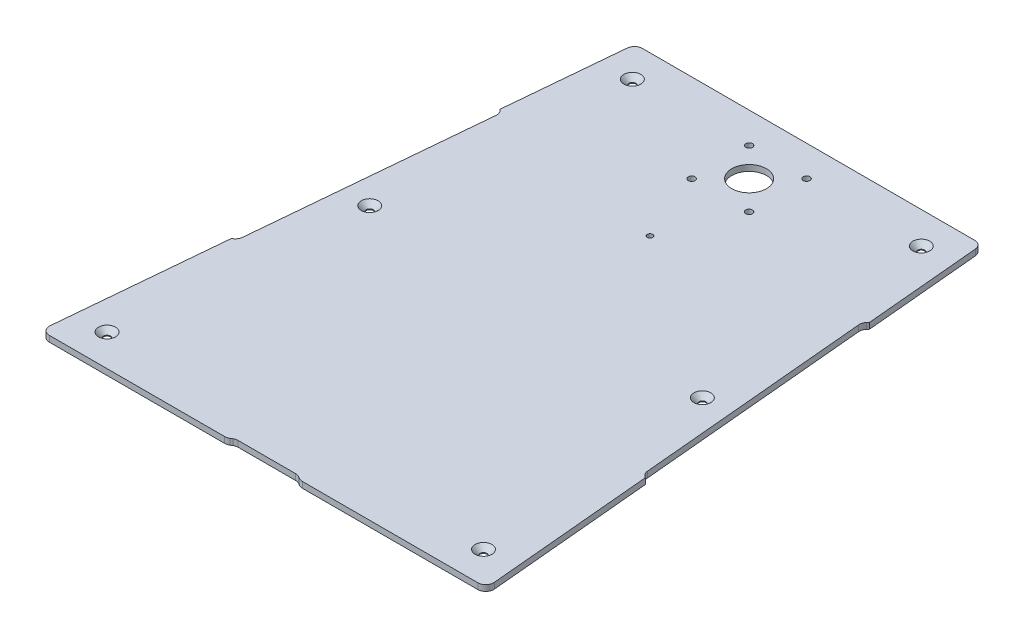
from build123d import *

# Parameters (mm, degrees)
SKETCH1_R           = 17.5
SKETCH1_R_2         = 3.4
SKETCH1_R_3         = 2.731026391
BOSS_EXTRUDE1_DEPTH = 6
FILLET1_R           = 8
SKETCH5_R           = 3.4
CUT_EXTRUDE4_DEPTH  = 20
CUT_EXTRUDE5_DEPTH  = 10
CUT_EXTRUDE6_DEPTH  = 10
FILLET2_R           = 8
CHAMFER1_SIZE       = 5.15


with BuildPart() as part:
    # Sketch1 → Boss-Extrude1 (new body)
    with BuildSketch(Plane(origin=(0, 0, 0), x_dir=(1, 0, 0), z_dir=(0, 1, 0))):
        Polygon((-175, 275), (-225, -275), (225, -275), (175, 275), align=None)
        with Locations(Location((0, 215, 0), (0, 0, 270))):
            Circle(SKETCH1_R, mode=Mode.SUBTRACT)
        with Locations(Location((-145.777131586, 243, 0), (0, 0, 270))):
            Circle(SKETCH1_R_2, mode=Mode.SUBTRACT)
        with Locations(Location((145.777131586, 243, 0), (0, 0, 90))):
            Circle(SKETCH1_R_2, mode=Mode.SUBTRACT)
        with Locations(Location((-189.958949768, -243, 0), (0, 0, 270))):
            Circle(SKETCH1_R_2, mode=Mode.SUBTRACT)
        with Locations(Location((189.958949768, -243, 0), (0, 0, 90))):
            Circle(SKETCH1_R_2, mode=Mode.SUBTRACT)
        with Locations(Location((-167.868040677, 0, 0), (0, 0, 270))):
            Circle(SKETCH1_R_2, mode=Mode.SUBTRACT)
        with Locations(Location((167.868040677, 0, 0), (0, 0, 90))):
            Circle(SKETCH1_R_2, mode=Mode.SUBTRACT)
        with Locations(Location((0, 115, 0), (0, 0, 270))):
            Circle(SKETCH1_R_3, mode=Mode.SUBTRACT)
    extrude(amount=-BOSS_EXTRUDE1_DEPTH)

    # Fillet1
    fillet1_edges = [part.edges().sort_by_distance(p)[0] for p in [
        (175, -3, -275),
        (225, -3, 275),
        (-225, -3, 275),
        (-175, -3, -275),
    ]]
    fillet(fillet1_edges, radius=FILLET1_R)

    # Sketch5 → Cut-Extrude4 (cut)
    with BuildSketch(Plane(origin=(0, 0, 377.333920735), x_dir=(0, 0, 1), z_dir=(0, 1, 0))):
        with Locations((-563.342542706, 28.991378029)):
            Circle(SKETCH5_R)
        with Locations((-563.342542706, -28.991378029)):
            Circle(SKETCH5_R)
        with Locations((-621.325298763, -28.991378029)):
            Circle(SKETCH5_R)
        with Locations((-621.325298763, 28.991378029)):
            Circle(SKETCH5_R)
    extrude(amount=-CUT_EXTRUDE4_DEPTH, mode=Mode.SUBTRACT)

    # Sketch6 → Cut-Extrude5 (cut)
    with BuildSketch(Plane(origin=(0, 0, 0), x_dir=(1, 0, 0), z_dir=(0, 1, 0))):
        Polygon((-204.631966366, -95.133074099), (-182.722315824, 145.873081867), (-194.245635018, 159.701064899), (-218.459949399, -106.656393293), align=None)
    cut_extrude5 = extrude(amount=-CUT_EXTRUDE5_DEPTH, mode=Mode.SUBTRACT)

    # Sketch7 → Cut-Extrude6 (cut)
    with BuildSketch(Plane(origin=(0, 0, 0), x_dir=(1, 0, 0), z_dir=(0, 1, 0))):
        Polygon((-31.320564901, -271.594250629), (31.320564901, -271.594250629), (45, -279.893229805), (-45, -279.893229805), align=None)
    extrude(amount=-CUT_EXTRUDE6_DEPTH, mode=Mode.SUBTRACT)

    # Mirror2: Cut-Extrude5 across plane
    add(cut_extrude5.mirror(Plane(origin=(0, 0, 0), x_dir=(0, 0, 1), z_dir=(1, 0, 0))), mode=Mode.SUBTRACT)

    # Fillet2
    fillet2_edges = [part.edges().sort_by_distance(p)[0] for p in [
        (-182.722315824, -3, -145.873081867),
        (-204.631966366, -3, 95.133074099),
        (36.934355042, -3, 275),
        (-36.934355042, -3, 275),
        (-31.320564901, -3, 271.594250629),
        (31.320564901, -3, 271.594250629),
        (204.631966366, -3, 95.133074099),
        (182.722315824, -3, -145.873081867),
    ]]
    fillet(fillet2_edges, radius=FILLET2_R)

    # Chamfer1
    chamfer1_edges = [part.edges().sort_by_distance(p)[0] for p in [
        (-145.777131586, 0, -246.4),
        (145.777131586, 0, -239.6),
        (-189.958949768, 0, 239.6),
        (189.958949768, 0, 246.4),
        (-167.868040677, 0, -3.4),
        (167.868040677, 0, 3.4),
    ]]
    chamfer(chamfer1_edges, length=CHAMFER1_SIZE)


solid = part.part
